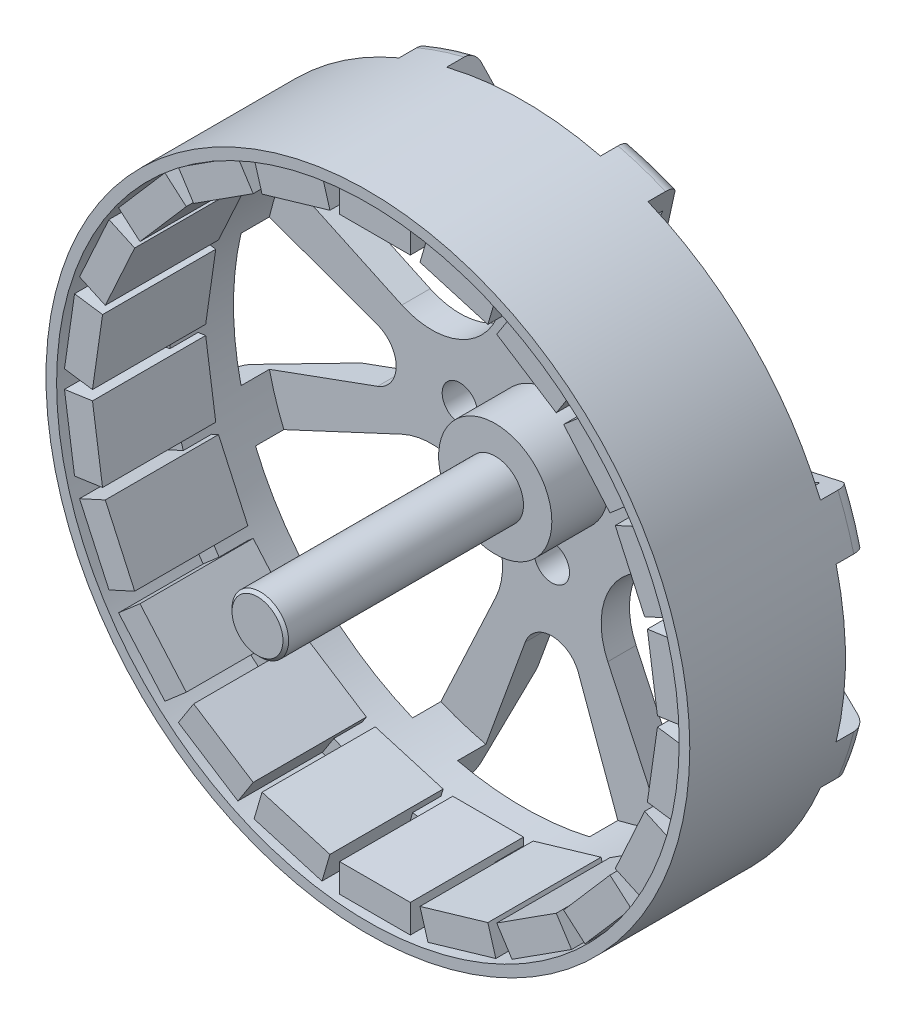
from build123d import *

# Parameters (mm, degrees)
SKETCH_1_R               = 22.75
EXTRUDE_1_DEPTH          = 15
SKETCH_2_R               = 22
CUT_EXTRUDE_1_DEPTH      = 6.5
SKETCH_3_R               = 20.5
CUT_EXTRUDE_2_DEPTH      = 6.5
SKETCH_4_R               = 4
EXTRUDE_2_DEPTH          = 4
CUT_EXTRUDE_6_REACH      = 37.498
SKETCH_12_R              = 2
SKETCH_5_R               = 2
EXTRUDE_3_DEPTH          = 22.8
CHAMFER_2_SIZE           = 0.2
CHAMFER_3_SIZE           = 7
CHAMFER_3_SIZE2          = 2
FILLET_1_R               = 1
SKETCH_7_W               = 1.25
SKETCH_7_H               = 2.001
M3X0_51_AT_2_COUNT       = 2
M3X0_51_AT_2_PITCH       = 13
M3X0_51_AT_3_COUNT       = 2
M3X0_51_AT_3_PITCH       = 9.192388155
M3X0_51_AT_4_COUNT       = 2
M3X0_51_AT_4_PITCH       = 9.192388155
CUT_EXTRUDE_3_DEPTH      = 4
CUT_EXTRUDE_4_DEPTH      = 4
SKETCH_13_W              = 5
SKETCH_13_H              = 2
EXTRUDE_6_DEPTH          = 8
PATTERN_CIRCULAR_5_COUNT = 22


with BuildPart() as part:
    # Эскиз1 → Бобышка-Вытянуть1 (new body)
    with BuildSketch(Plane.XY):
        Circle(SKETCH_1_R)
    extrude(amount=EXTRUDE_1_DEPTH)

    # Эскиз2 → Вырез-Вытянуть1 (cut)
    with BuildSketch(Plane.XY.offset(15)):
        Circle(SKETCH_2_R)
    extrude(amount=-CUT_EXTRUDE_1_DEPTH, mode=Mode.SUBTRACT)

    # Эскиз3 → Вырез-Вытянуть2 (cut)
    with BuildSketch(Plane.XY.offset(8.5)):
        Circle(SKETCH_3_R)
    extrude(amount=-CUT_EXTRUDE_2_DEPTH, mode=Mode.SUBTRACT)

    # Эскиз4 → Бобышка-Вытянуть2 (add)
    with BuildSketch(Plane.XY.offset(2)):
        Circle(SKETCH_4_R)
    extrude(amount=EXTRUDE_2_DEPTH)

    # Эскиз12 → Вырез-Вытянуть6 (cut, up to next)
    with BuildSketch(Plane(origin=(0, 0, 0), x_dir=(-1, 0, 0), z_dir=(0, 0, -1)), mode=Mode.PRIVATE) as cut_extrude_6_sk1:
        Circle(SKETCH_12_R)
    cut_extrude_6_tool1 = extrude(cut_extrude_6_sk1.sketch, amount=-CUT_EXTRUDE_6_REACH, mode=Mode.PRIVATE) & part.part
    add(cut_extrude_6_tool1.solids().sort_by_distance((0, 0, 0))[0], mode=Mode.SUBTRACT)

    # Фаска3
    chamfer_3_edges = [part.edges().sort_by_distance(p)[0] for p in [
        (-22.75, 0, 0),
    ]]
    chamfer_3_side = [part.faces().sort_by_distance(p)[0] for p in [
        (-22.106532829, 0, 0),
    ]]
    chamfer(chamfer_3_edges, length=CHAMFER_3_SIZE, length2=CHAMFER_3_SIZE2, reference=chamfer_3_side[0])

    # Скругление1
    fillet_1_edges = [part.edges().sort_by_distance(p)[0] for p in [
        (-22.75, 0, 2),
        (-15.75, 0, 0),
    ]]
    fillet(fillet_1_edges, radius=FILLET_1_R)

    # Эскиз7 → Отверстие обработанное метчиком M3x0.51 (revolve, cut)
    with BuildSketch(Plane(origin=(0, 6.5, 0), x_dir=(0, 1, 0), z_dir=(1, 0, 0))):
        with Locations((0.625, 1.0005)):
            Rectangle(SKETCH_7_W, SKETCH_7_H)
    m3x0_51 = revolve(axis=Axis((0, 6.5, -6.35), (0, 0, 1)), mode=Mode.SUBTRACT)

    # Отверстие обработанное метчиком M3x0.51 at 2: Отверстие обработанное метчиком M3x0.51 ×2
    with Locations(*[(0, -i * M3X0_51_AT_2_PITCH, 0) for i in range(1, M3X0_51_AT_2_COUNT)]):
        add(m3x0_51, mode=Mode.SUBTRACT)

    # Отверстие обработанное метчиком M3x0.51 at 3: Отверстие обработанное метчиком M3x0.51 ×2
    with Locations(*[Vector(-0.7071067811865476, -0.7071067811865476, 0) * (i * M3X0_51_AT_3_PITCH) for i in range(1, M3X0_51_AT_3_COUNT)]):
        add(m3x0_51, mode=Mode.SUBTRACT)

    # Отверстие обработанное метчиком M3x0.51 at 4: Отверстие обработанное метчиком M3x0.51 ×2
    with Locations(*[Vector(0.7071067811865476, -0.7071067811865476, 0) * (i * M3X0_51_AT_4_PITCH) for i in range(1, M3X0_51_AT_4_COUNT)]):
        add(m3x0_51, mode=Mode.SUBTRACT)

    # Эскиз9 → Вырез-Вытянуть3 (cut)
    with BuildSketch(Plane(origin=(0, 0, 0), x_dir=(-1, 0, 0), z_dir=(0, 0, -1))):
        with BuildLine():
            Line((3.953742439, 10.598372683), (8.795277075, 20.981077217))
            ThreePointArc((8.795277075, 20.981077217), (16.086679272, 16.086679272), (20.981077217, 8.795277075))
            Line((20.981077217, 8.795277075), (10.598372683, 3.953742439))
            ThreePointArc((10.598372683, 3.953742439), (4.949747468, 4.949747468), (3.953742439, 10.598372683))
        make_face()
        with BuildLine():
            Line((10.598372683, -3.953742439), (20.981077217, -8.795277075))
            ThreePointArc((20.981077217, -8.795277075), (16.086679272, -16.086679272), (8.795277075, -20.981077217))
            Line((8.795277075, -20.981077217), (3.953742439, -10.598372683))
            ThreePointArc((3.953742439, -10.598372683), (4.949747468, -4.949747468), (10.598372683, -3.953742439))
        make_face()
        with BuildLine():
            Line((-3.953742439, -10.598372683), (-8.795277075, -20.981077217))
            ThreePointArc((-8.795277075, -20.981077217), (-16.086679272, -16.086679272), (-20.981077217, -8.795277075))
            Line((-20.981077217, -8.795277075), (-10.598372683, -3.953742439))
            ThreePointArc((-10.598372683, -3.953742439), (-4.949747468, -4.949747468), (-3.953742439, -10.598372683))
        make_face()
        with BuildLine():
            Line((-10.598372683, 3.953742439), (-20.981077217, 8.795277075))
            ThreePointArc((-20.981077217, 8.795277075), (-16.086679272, 16.086679272), (-8.795277075, 20.981077217))
            Line((-8.795277075, 20.981077217), (-3.953742439, 10.598372683))
            ThreePointArc((-3.953742439, 10.598372683), (-4.949747468, 4.949747468), (-10.598372683, 3.953742439))
        make_face()
    extrude(amount=-CUT_EXTRUDE_3_DEPTH, mode=Mode.SUBTRACT)


with BuildPart() as body_2:
    # Эскиз5 → Бобышка-Вытянуть3 (new body)
    with BuildSketch(Plane(origin=(0, 0, 0), x_dir=(-1, 0, 0), z_dir=(0, 0, -1))):
        Circle(SKETCH_5_R)
    extrude(amount=-EXTRUDE_3_DEPTH)

    # Фаска2
    chamfer_2_edges = [body_2.edges().sort_by_distance(p)[0] for p in [
        (2, 0, 0),
        (2, 0, 22.8),
    ]]
    chamfer(chamfer_2_edges, length=CHAMFER_2_SIZE)


with BuildPart() as cut_extrude_3_kept_piece:
    # of the separate pieces the step leaves, the one the design keeps (cut_extrude_3_pieces_kept)
    add(part.part.solids().sort_by_distance((22.75, 0, 2.754301413))[0])

    # Эскиз10 → Вырез-Вытянуть4 (cut)
    with BuildSketch(Plane(origin=(0, 0, 0), x_dir=(-1, 0, 0), z_dir=(0, 0, -1))):
        with BuildLine():
            Line((-1.879385242, 12.315959713), (-5.437110488, 22.090729493))
            ThreePointArc((-5.437110488, 22.090729493), (0, 22.75), (5.437110488, 22.090729493))
            Line((5.437110488, 22.090729493), (1.879385242, 12.315959713))
            ThreePointArc((1.879385242, 12.315959713), (0, 11), (-1.879385242, 12.315959713))
        make_face()
        with BuildLine():
            Line((12.315959713, 1.879385242), (22.090729493, 5.437110488))
            ThreePointArc((22.090729493, 5.437110488), (22.75, 0), (22.090729493, -5.437110488))
            Line((22.090729493, -5.437110488), (12.315959713, -1.879385242))
            ThreePointArc((12.315959713, -1.879385242), (11, 0), (12.315959713, 1.879385242))
        make_face()
        with BuildLine():
            Line((1.879385242, -12.315959713), (5.437110488, -22.090729493))
            ThreePointArc((5.437110488, -22.090729493), (0, -22.75), (-5.437110488, -22.090729493))
            Line((-5.437110488, -22.090729493), (-1.879385242, -12.315959713))
            ThreePointArc((-1.879385242, -12.315959713), (0, -11), (1.879385242, -12.315959713))
        make_face()
        with BuildLine():
            Line((-12.315959713, -1.879385242), (-22.090729493, -5.437110488))
            ThreePointArc((-22.090729493, -5.437110488), (-22.75, 0), (-22.090729493, 5.437110488))
            Line((-22.090729493, 5.437110488), (-12.315959713, 1.879385242))
            ThreePointArc((-12.315959713, 1.879385242), (-11, 0), (-12.315959713, -1.879385242))
        make_face()
    extrude(amount=-CUT_EXTRUDE_4_DEPTH, mode=Mode.SUBTRACT)

    # Эскиз13 → Бобышка-Вытянуть6 (add)
    with BuildSketch(Plane.XY.offset(14.5)):
        with Locations((0, 20.808704804)):
            Rectangle(SKETCH_13_W, SKETCH_13_H)
    extrude_6 = extrude(amount=-EXTRUDE_6_DEPTH)

    # Круговой массив5: Бобышка-Вытянуть6 ×22 about axis
    pattern_circular_5_axis = Axis((0, 0, 0), (0, 0, 1))
    for i in range(1, PATTERN_CIRCULAR_5_COUNT):
        add(extrude_6.rotate(pattern_circular_5_axis, i * 360 / PATTERN_CIRCULAR_5_COUNT))


solid = Compound([body_2.part, cut_extrude_3_kept_piece.part])
